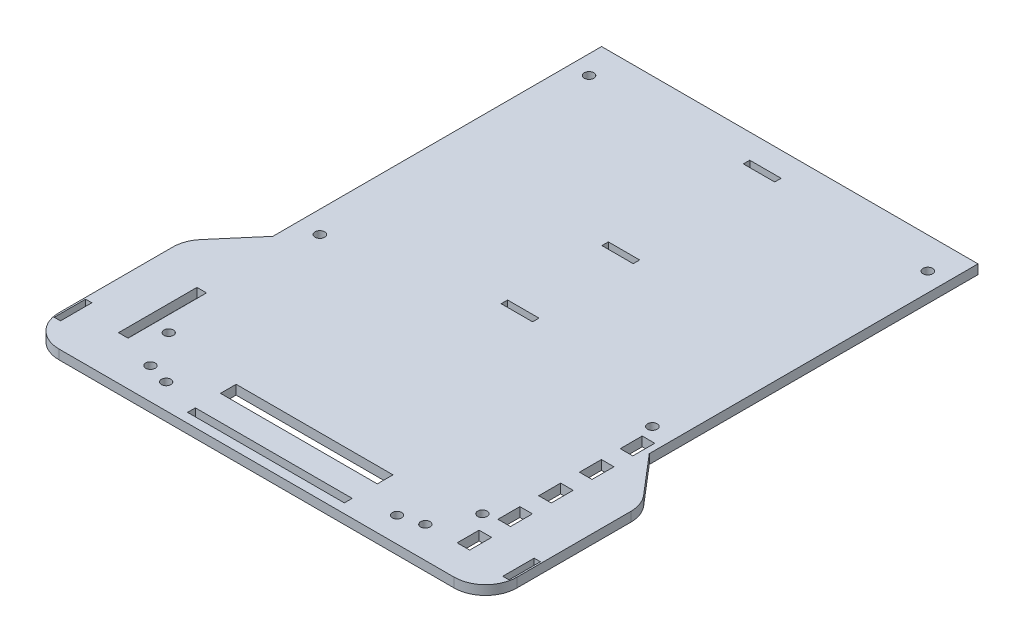
from build123d import *

# Parameters (mm, degrees)
BOSS_EXTRUDE1_DEPTH = 3
SKETCH2_R           = 1.525
CUT_EXTRUDE1_DEPTH  = 113.084789334
SKETCH3_W           = 10
SKETCH3_H           = 2.05
CUT_EXTRUDE2_DEPTH  = 113.084789334
SKETCH4_R           = 1.5
CUT_EXTRUDE3_DEPTH  = 3
SKETCH5_R           = 1.5
SKETCH5_W           = 50
SKETCH5_H           = 5
CUT_EXTRUDE4_DEPTH  = 3
SKETCH6_W           = 4
SKETCH6_H           = 7
CUT_EXTRUDE5_DEPTH  = 10
SKETCH7_W           = 50
SKETCH7_H           = 2.5
SKETCH7_W_2         = 3.05
SKETCH7_H_2         = 25
CUT_EXTRUDE6_DEPTH  = 10
FILLET3_R           = 10
SKETCH8_W           = 2
SKETCH8_H           = 10
CUT_EXTRUDE7_DEPTH  = 10


with BuildPart() as part:
    # Sketch1 → Boss-Extrude1 (new body)
    with BuildSketch(Plane(origin=(0, 0, 0), x_dir=(1, 0, 0), z_dir=(0, 1, 0))):
        Polygon((-73, -35), (-60, -19.801315846), (-60, 85), (60, 85), (60, -19.801315846), (73, -35), (73, -85), (60, -85), (-60, -85), (-73, -85), align=None)
    extrude(amount=BOSS_EXTRUDE1_DEPTH)

    # Sketch2 → Cut-Extrude1 (cut, through all)
    with BuildSketch(Plane(origin=(0, 3, 0), x_dir=(1, 0, 0), z_dir=(0, 1, 0))):
        with Locations(Location((-53, -11.81, 0), (0, 0, 270))):
            Circle(SKETCH2_R)
        with Locations(Location((-54, 75, 0), (0, 0, 270))):
            Circle(SKETCH2_R)
        with Locations(Location((53, -11.81, 0), (0, 0, 90))):
            Circle(SKETCH2_R)
        with Locations(Location((54, 75, 0), (0, 0, 90))):
            Circle(SKETCH2_R)
    extrude(amount=-CUT_EXTRUDE1_DEPTH, mode=Mode.SUBTRACT)

    # Sketch3 → Cut-Extrude2 (cut, through all)
    with BuildSketch(Plane(origin=(0, 3, 0), x_dir=(1, 0, 0), z_dir=(0, 1, 0))):
        with Locations((0, 31.115)):
            Rectangle(SKETCH3_W, SKETCH3_H)
        with Locations((0, -0.985)):
            Rectangle(SKETCH3_W, SKETCH3_H)
        with Locations((0, 76.215)):
            Rectangle(SKETCH3_W, SKETCH3_H)
    extrude(amount=-CUT_EXTRUDE2_DEPTH, mode=Mode.SUBTRACT)

    # Sketch4 → Cut-Extrude3 (cut)
    with BuildSketch(Plane(origin=(0, 3, 0), x_dir=(1, 0, 0), z_dir=(0, 1, 0))):
        with Locations(Location((-50, -63, 0), (0, 0, 270))):
            Circle(SKETCH4_R)
        with Locations(Location((-43.815341562, -75, 0), (0, 0, 270))):
            Circle(SKETCH4_R)
        with Locations(Location((43.815341562, -75, 0), (0, 0, 90))):
            Circle(SKETCH4_R)
        with Locations(Location((50, -63, 0), (0, 0, 90))):
            Circle(SKETCH4_R)
    extrude(amount=-CUT_EXTRUDE3_DEPTH, mode=Mode.SUBTRACT)

    # Sketch5 → Cut-Extrude4 (cut)
    with BuildSketch(Plane(origin=(0, 3, 0), x_dir=(1, 0, 0), z_dir=(0, 1, 0))):
        with Locations(Location((-36.8, -77, 0), (0, 0, 270))):
            Circle(SKETCH5_R)
        with Locations(Location((36.8, -77, 0), (0, 0, 90))):
            Circle(SKETCH5_R)
        with Locations((0, -69)):
            Rectangle(SKETCH5_W, SKETCH5_H)
    extrude(amount=-CUT_EXTRUDE4_DEPTH, mode=Mode.SUBTRACT)

    # Sketch6 → Cut-Extrude5 (cut)
    with BuildSketch(Plane(origin=(0, 3, 0), x_dir=(1, 0, 0), z_dir=(0, 1, 0))):
        with Locations((56, -32.549614417)):
            Rectangle(SKETCH6_W, SKETCH6_H)
        with Locations((56, -19.549614417)):
            Rectangle(SKETCH6_W, SKETCH6_H)
        with Locations((56, -45.549614417)):
            Rectangle(SKETCH6_W, SKETCH6_H)
        with Locations((56, -58.549614417)):
            Rectangle(SKETCH6_W, SKETCH6_H)
        with Locations((56, -71.549614417)):
            Rectangle(SKETCH6_W, SKETCH6_H)
    extrude(amount=-CUT_EXTRUDE5_DEPTH, mode=Mode.SUBTRACT)

    # Sketch7 → Cut-Extrude6 (cut)
    with BuildSketch(Plane(origin=(0, 3, 0), x_dir=(1, 0, 0), z_dir=(0, 1, 0))):
        with Locations((0, -80.75)):
            Rectangle(SKETCH7_W, SKETCH7_H)
        with Locations((-56.475, -58.5)):
            Rectangle(SKETCH7_W_2, SKETCH7_H_2)
    extrude(amount=-CUT_EXTRUDE6_DEPTH, mode=Mode.SUBTRACT)

    # Fillet3
    fillet3_edges = [part.edges().sort_by_distance(p)[0] for p in [
        (73, 1.5, 35),
        (73, 1.5, 85),
        (-73, 1.5, 85),
        (-73, 1.5, 35),
    ]]
    fillet(fillet3_edges, radius=FILLET3_R)

    # Sketch8 → Cut-Extrude7 (cut)
    with BuildSketch(Plane(origin=(0, 3, 0), x_dir=(1, 0, 0), z_dir=(0, 1, 0))):
        with Locations((71.5, -72)):
            Rectangle(SKETCH8_W, SKETCH8_H)
        with Locations((-71.5, -72)):
            Rectangle(SKETCH8_W, SKETCH8_H)
    extrude(amount=-CUT_EXTRUDE7_DEPTH, mode=Mode.SUBTRACT)


solid = part.part
